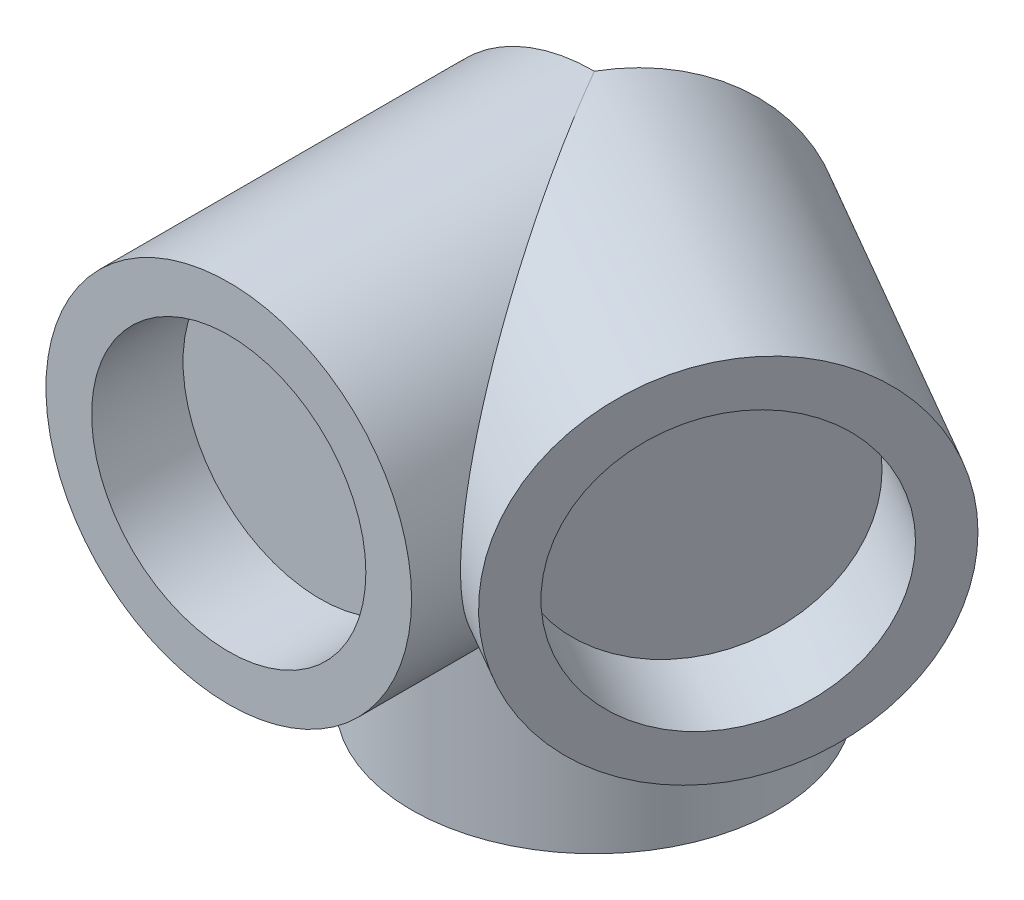
from build123d import *

# Parameters (mm, degrees)
SKETCH1_R           = 10
BOSS_EXTRUDE1_DEPTH = 10
SKETCH2_R           = 7.5
CUT_EXTRUDE1_DEPTH  = 5
SKETCH7_R           = 10
BOSS_EXTRUDE2_DEPTH = 20
SKETCH9_R           = 10
BOSS_EXTRUDE3_DEPTH = 20
SKETCH10_R          = 7.5
CUT_EXTRUDE2_DEPTH  = 5
SKETCH11_R          = 7.5
CUT_EXTRUDE3_DEPTH  = 5


with BuildPart() as part:
    # Sketch1 → Boss-Extrude1 (new body)
    with BuildSketch(Plane(origin=(0, 0, 0), x_dir=(1, 0, 0), z_dir=(0, 1, 0))):
        Circle(SKETCH1_R)
    extrude(amount=-BOSS_EXTRUDE1_DEPTH)

    # Sketch2 → Cut-Extrude1 (cut)
    with BuildSketch(Plane.XZ.offset(10)):
        Circle(SKETCH2_R)
    extrude(amount=-CUT_EXTRUDE1_DEPTH, mode=Mode.SUBTRACT)


with BuildPart() as body_2:
    # Sketch7 → Boss-Extrude2 (new body)
    with BuildSketch(Plane(origin=(0, 0, 0), x_dir=(0, -1, 0), z_dir=(0.866025403784438, 0, 0.500000000000001))):
        with Locations((-10, 0)):
            Circle(SKETCH7_R)
    extrude(amount=BOSS_EXTRUDE2_DEPTH)

    # Sketch9 → Boss-Extrude3 (add)
    with BuildSketch(Plane.XY):
        with Locations((0, 10)):
            Circle(SKETCH9_R)
    extrude(amount=BOSS_EXTRUDE3_DEPTH)

    # Sketch10 → Cut-Extrude2 (cut)
    with BuildSketch(Plane.XY.offset(20)):
        with Locations((0, 10)):
            Circle(SKETCH10_R)
    extrude(amount=-CUT_EXTRUDE2_DEPTH, mode=Mode.SUBTRACT)

    # Sketch11 → Cut-Extrude3 (cut)
    with BuildSketch(Plane(origin=(17.320508076, 0, 10), x_dir=(0.500000000000001, 0, -0.8660254037844382), z_dir=(0.8660254037844382, 0, 0.500000000000001))):
        with Locations((0, 10)):
            Circle(SKETCH11_R)
    extrude(amount=-CUT_EXTRUDE3_DEPTH, mode=Mode.SUBTRACT)


solid = Compound([part.part, body_2.part])
